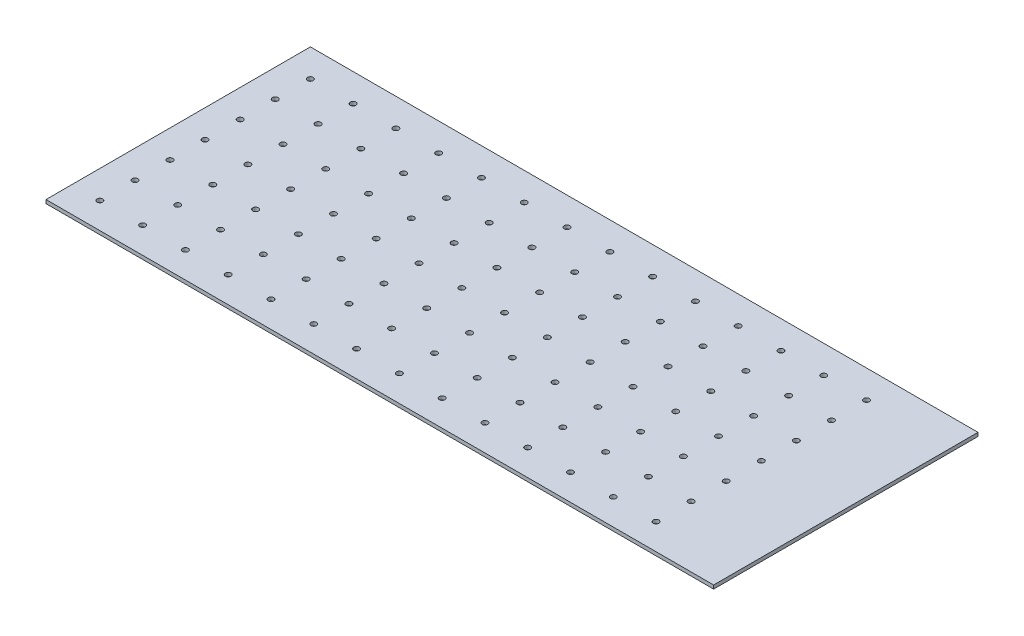
from build123d import *

# Parameters (mm, degrees)
SKETCH1_W            = 540
SKETCH1_H            = 233.64
BOSS_EXTRUDE1_DEPTH  = 3.18
CUT_EXTRUDE1_REACH   = 296.206
SKETCH2_R            = 2.5
LPATTERN1_COUNT      = 14
LPATTERN1_PITCH      = 37.81
LPATTERN1_COUNT_DIR2 = 7
LPATTERN1_PITCH_DIR2 = 31
SKETCH3_W            = 233.64
SKETCH3_H            = 3.18
BOSS_EXTRUDE2_DEPTH  = 50


with BuildPart() as part:
    # Sketch1 → Boss-Extrude1 (new body)
    with BuildSketch(Plane(origin=(0, 0, 0), x_dir=(1, 0, 0), z_dir=(0, 1, 0))):
        Rectangle(SKETCH1_W, SKETCH1_H)
    extrude(amount=BOSS_EXTRUDE1_DEPTH)

    # Sketch2 → Cut-Extrude1 (cut, up to next)
    with BuildSketch(Plane(origin=(0, 3.18, 0), x_dir=(1, 0, 0), z_dir=(0, 1, 0)), mode=Mode.PRIVATE) as cut_extrude1_sk1:
        with Locations(Location((-245.45, 92.22, 0), (0, 0, 270))):
            Circle(SKETCH2_R)
    cut_extrude1_tool1 = extrude(cut_extrude1_sk1.sketch, amount=-CUT_EXTRUDE1_REACH, mode=Mode.PRIVATE) & part.part
    cut_extrude1 = cut_extrude1_tool1.solids().sort_by_distance((-245.45, 3.18, -92.22))[0]
    add(cut_extrude1, mode=Mode.SUBTRACT)

    # LPattern1: Cut-Extrude1 14 × 7
    with Locations(*[(i * LPATTERN1_PITCH, 0, j * LPATTERN1_PITCH_DIR2) for i in range(LPATTERN1_COUNT) for j in range(LPATTERN1_COUNT_DIR2) if (i, j) != (0, 0)]):
        add(cut_extrude1, mode=Mode.SUBTRACT)

    # Sketch3 → Boss-Extrude2 (add)
    with BuildSketch(Plane(origin=(270, 0, 0), x_dir=(0, 0, -1), z_dir=(1, 0, 0))):
        with Locations((0, 1.59)):
            Rectangle(SKETCH3_W, SKETCH3_H)
    extrude(amount=BOSS_EXTRUDE2_DEPTH)


solid = part.part
